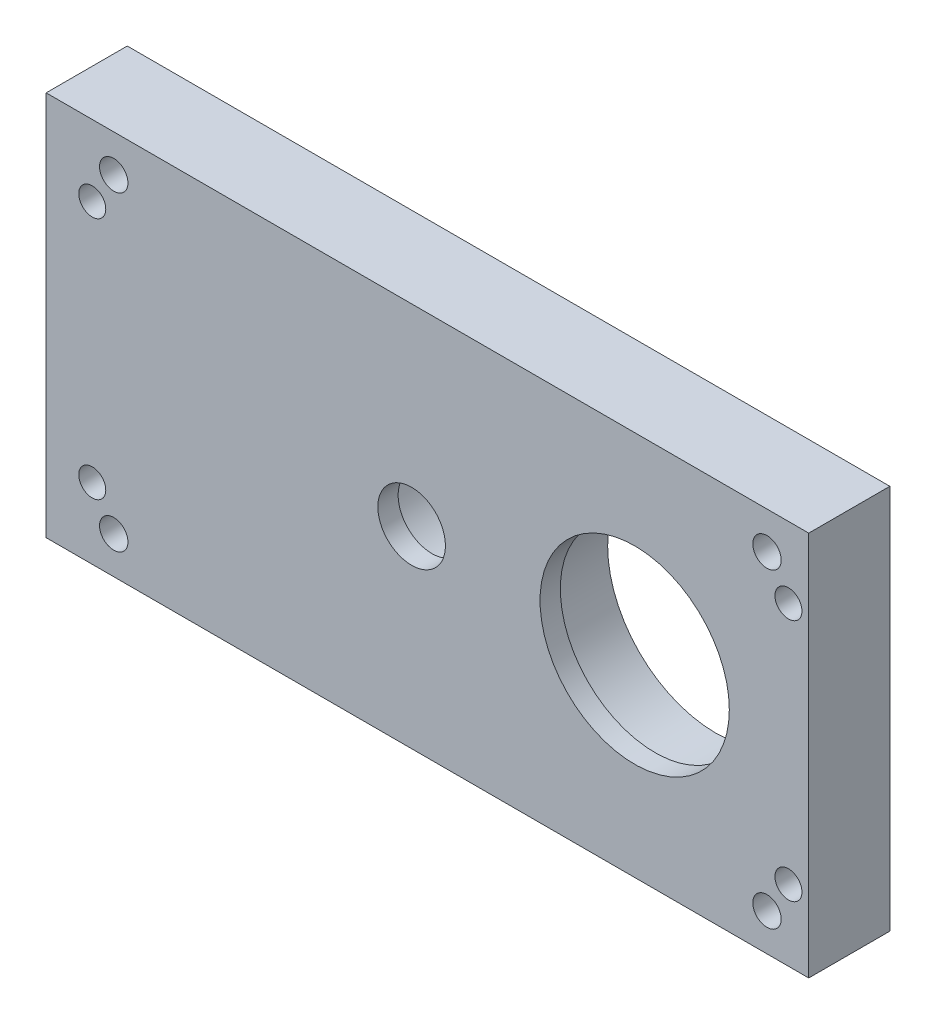
from build123d import *

# Parameters (mm, degrees)
ESBO_O1_W                = 118
ESBO_O1_H                = 62
ESBO_O1_R                = 9.5
ESBO_O1_R_2              = 16
ESBO_O1_R_3              = 2
RESSALTO_EXTRUS_O1_DEPTH = 12
FURO_COM_FOLGA_DE_M51_D  = 4.2
RESSALTO_EXTRUS_O4_START = -3
ESBO_O17_R               = 9.5
RESSALTO_EXTRUS_O4_DEPTH = 3
ESBO_O18_W               = 118
ESBO_O18_H               = 62
ESBO_O18_W_2             = 112.82
ESBO_O18_H_2             = 57
CORTE_EXTRUS_O3_DEPTH    = 68.720011813
RESSALTO_EXTRUS_O5_START = -3
ESBO_O19_R               = 16
ESBO_O19_R_2             = 14
RESSALTO_EXTRUS_O5_DEPTH = 3
ESBO_O21_R               = 5
CORTE_EXTRUS_O4_DEPTH    = 10


with BuildPart() as part:
    # Esboço1 → Ressalto-extrusão1 (new body)
    with BuildSketch(Plane.XY):
        Rectangle(ESBO_O1_W, ESBO_O1_H)
        with Locations((-4.25, 0)):
            Circle(ESBO_O1_R, mode=Mode.SUBTRACT)
        with Locations((28.75, 0)):
            Circle(ESBO_O1_R_2, mode=Mode.SUBTRACT)
        with Locations((51.5, -18)):
            Circle(ESBO_O1_R_3, mode=Mode.SUBTRACT)
        with Locations((51.5, 18)):
            Circle(ESBO_O1_R_3, mode=Mode.SUBTRACT)
        with Locations((-51.5, -18)):
            Circle(ESBO_O1_R_3, mode=Mode.SUBTRACT)
        with Locations((-51.5, 18)):
            Circle(ESBO_O1_R_3, mode=Mode.SUBTRACT)
    extrude(amount=RESSALTO_EXTRUS_O1_DEPTH)

    # Furo com folga de M51 (through all)
    with Locations(Plane.XY.offset(12)):
        with Locations((-48.32, 23), (-48.32, -23), (48.32, -23), (48.32, 23)):
            Hole(FURO_COM_FOLGA_DE_M51_D / 2)

    # Esboço17 → Ressalto-extrusão4 (add)
    with BuildSketch(Plane.XY.offset(12).offset(RESSALTO_EXTRUS_O4_START)):
        with Locations((-4.25, 0)):
            Circle(ESBO_O17_R)
    extrude(amount=RESSALTO_EXTRUS_O4_DEPTH)

    # Esboço18 → Corte-extrusão3 (cut, through all)
    with BuildSketch(Plane.XY.offset(12)):
        Rectangle(ESBO_O18_W, ESBO_O18_H)
        with Locations((-1.91, 0)):
            Rectangle(ESBO_O18_W_2, ESBO_O18_H_2, mode=Mode.SUBTRACT)
    extrude(amount=-CORTE_EXTRUS_O3_DEPTH, mode=Mode.SUBTRACT)

    # Esboço19 → Ressalto-extrusão5 (add)
    with BuildSketch(Plane.XY.offset(12).offset(RESSALTO_EXTRUS_O5_START)):
        with Locations((28.75, 0)):
            Circle(ESBO_O19_R)
        with Locations((28.75, 0)):
            Circle(ESBO_O19_R_2, mode=Mode.SUBTRACT)
    extrude(amount=RESSALTO_EXTRUS_O5_DEPTH)

    # Esboço21 → Corte-extrusão4 (cut)
    with BuildSketch(Plane(origin=(0, 0, 9), x_dir=(-1, 0, 0), z_dir=(0, 0, -1))):
        with Locations((4.25, 0)):
            Circle(ESBO_O21_R)
    extrude(amount=-CORTE_EXTRUS_O4_DEPTH, mode=Mode.SUBTRACT)


solid = part.part
